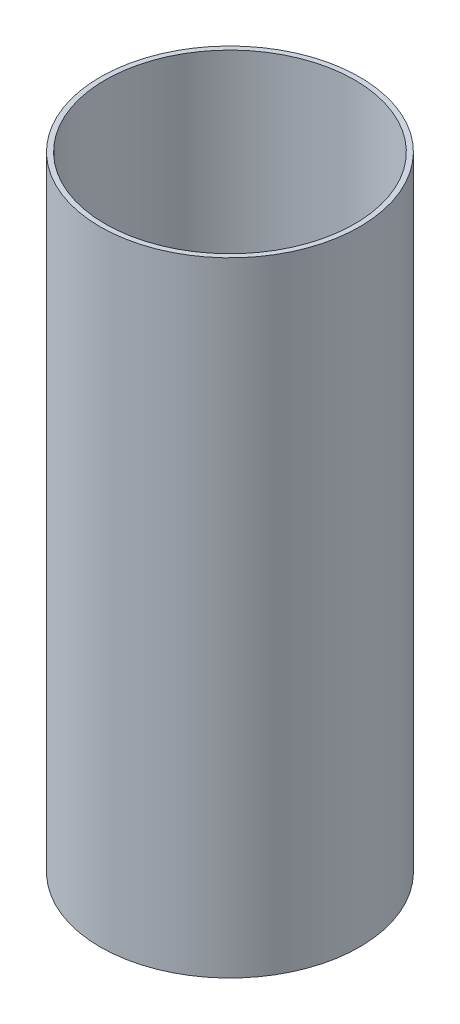
from build123d import *

# Parameters (mm, degrees)
SKETCH2_R           = 39.624
SKETCH2_R_2         = 38.1
BOSS_EXTRUDE1_DEPTH = 190.5


with BuildPart() as part:
    # Sketch2 → Boss-Extrude1 (new body)
    with BuildSketch(Plane(origin=(0, 0, 0), x_dir=(1, 0, 0), z_dir=(0, 1, 0))):
        with Locations(Location((0, 0, 0), (0, 0, 270))):
            Circle(SKETCH2_R)
        with Locations(Location((0, 0, 0), (0, 0, 270))):
            Circle(SKETCH2_R_2, mode=Mode.SUBTRACT)
    extrude(amount=BOSS_EXTRUDE1_DEPTH)


solid = part.part
